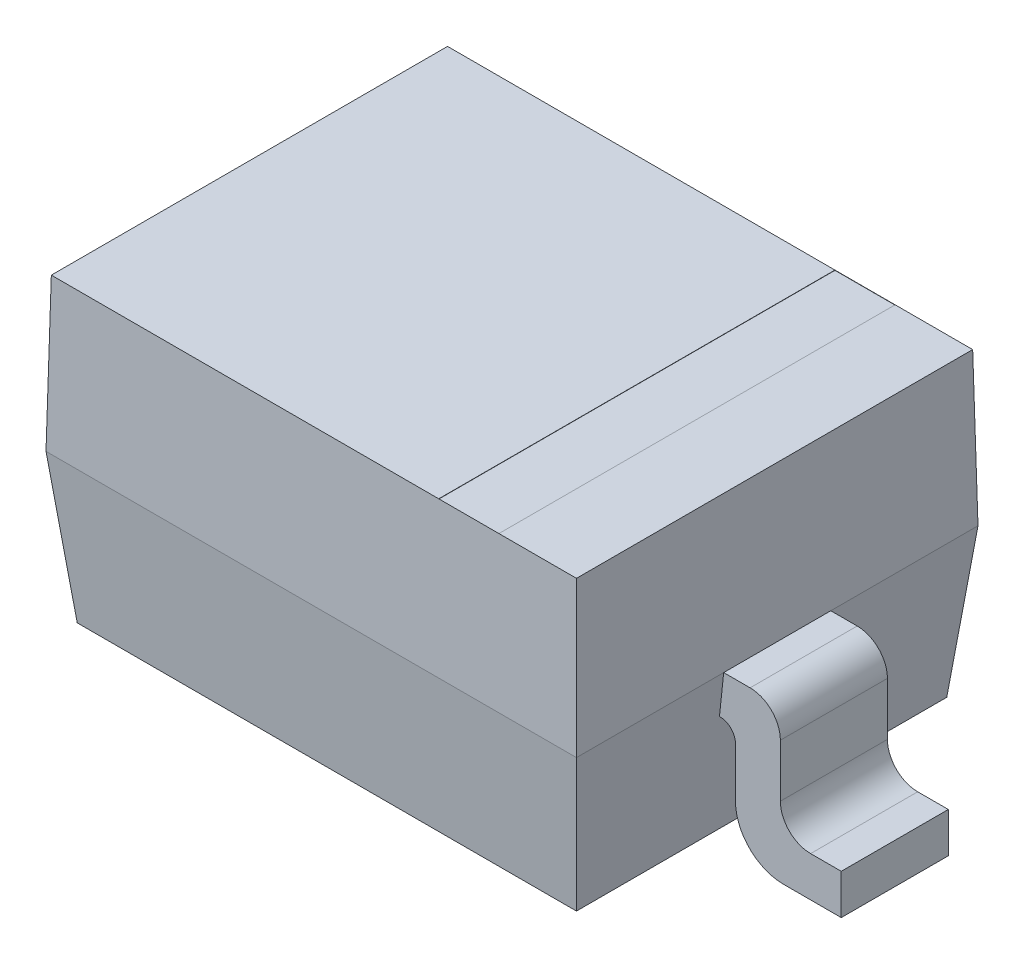
from build123d import *

# Parameters (mm, degrees)
SALIENTE_EXTRUIR1_DEPTH           = 0.4
CROQUIS2_W                        = 1.98162794
CROQUIS2_H                        = 1.5
SALIENTE_EXTRUIR2_DEPTH           = 0.57
SALIENTE_EXTRUIR2_TAPER           = 1
SALIENTE_EXTRUIR2_OTHER_WAY_DEPTH = 0.555
SALIENTE_EXTRUIR2_OTHER_WAY_TAPER = 6
CROQUIS3_W                        = 0.224871427
CROQUIS3_H                        = 1.480101226
CORTAR_EXTRUIR1_DEPTH             = 0.001


with BuildPart() as part:
    # Croquis1 → Saliente-Extruir1 (new body)
    with BuildSketch(Plane.XY):
        with BuildLine():
            Line((0, 0), (-1.95, 0))
            Line((-1.95, 0), (-2.064476059, 0))
            ThreePointArc((-2.064476059, 0), (-2.144382121, -0.033098174), (-2.177480296, -0.113004236))
            Line((-2.177480296, -0.113004236), (-2.177480296, -0.15))
            Line((-2.177480296, -0.15), (-2.177480296, -0.310274433))
            ThreePointArc((-2.177480296, -0.310274433), (-2.21057847, -0.390180495), (-2.290484532, -0.42327867))
            Line((-2.290484532, -0.42327867), (-2.404960591, -0.42327867))
            Line((-2.404960591, -0.42327867), (-2.404960591, -0.573201369))
            Line((-2.404960591, -0.573201369), (-2.189097343, -0.573201369))
            ThreePointArc((-2.189097343, -0.573201369), (-2.062251222, -0.520659985), (-2.009709838, -0.393813864))
            Line((-2.009709838, -0.393813864), (-2.009709838, -0.207208661))
            ThreePointArc((-2.009709838, -0.207208661), (-1.992953809, -0.166756029), (-1.952501178, -0.15))
            Line((-1.952501178, -0.15), (-1.95, -0.15))
            Line((-1.95, -0.15), (0, -0.15))
            Line((0, -0.15), (0.002501178, -0.15))
            ThreePointArc((0.002501178, -0.15), (0.042953809, -0.166756029), (0.059709838, -0.207208661))
            Line((0.059709838, -0.207208661), (0.059709838, -0.393813864))
            ThreePointArc((0.059709838, -0.393813864), (0.112251222, -0.520659985), (0.239097343, -0.573201369))
            Line((0.239097343, -0.573201369), (0.454960591, -0.573201369))
            Line((0.454960591, -0.573201369), (0.454960591, -0.42327867))
            Line((0.454960591, -0.42327867), (0.340484532, -0.42327867))
            ThreePointArc((0.340484532, -0.42327867), (0.26057847, -0.390180495), (0.227480296, -0.310274433))
            Line((0.227480296, -0.310274433), (0.227480296, -0.15))
            Line((0.227480296, -0.15), (0.227480296, -0.113004236))
            ThreePointArc((0.227480296, -0.113004236), (0.194382121, -0.033098174), (0.114476059, 0))
            Line((0.114476059, 0), (0, 0))
        make_face()
    extrude(amount=SALIENTE_EXTRUIR1_DEPTH)

    # Croquis2 → Saliente-Extruir2 (add)
    with BuildSketch(Plane(origin=(0, 0, 0), x_dir=(1, 0, 0), z_dir=(0, 1, 0))):
        with Locations((-0.975, -0.2)):
            Rectangle(CROQUIS2_W, CROQUIS2_H)
    extrude(amount=SALIENTE_EXTRUIR2_DEPTH, taper=SALIENTE_EXTRUIR2_TAPER)

    # Croquis2 → Saliente-Extruir2 other way (add)
    with BuildSketch(Plane(origin=(0, 0, 0), x_dir=(1, 0, 0), z_dir=(0, 1, 0))):
        with Locations((-0.975, -0.2)):
            Rectangle(CROQUIS2_W, CROQUIS2_H)
    extrude(amount=-SALIENTE_EXTRUIR2_OTHER_WAY_DEPTH, taper=SALIENTE_EXTRUIR2_OTHER_WAY_TAPER)

    # Croquis3 → Cortar-Extruir1 (cut)
    with BuildSketch(Plane(origin=(0, 0.57, 0), x_dir=(1, 0, 0), z_dir=(0, 1, 0))):
        with Locations((-0.396211414, -0.2)):
            Rectangle(CROQUIS3_W, CROQUIS3_H)
    extrude(amount=-CORTAR_EXTRUIR1_DEPTH, mode=Mode.SUBTRACT)


solid = part.part
